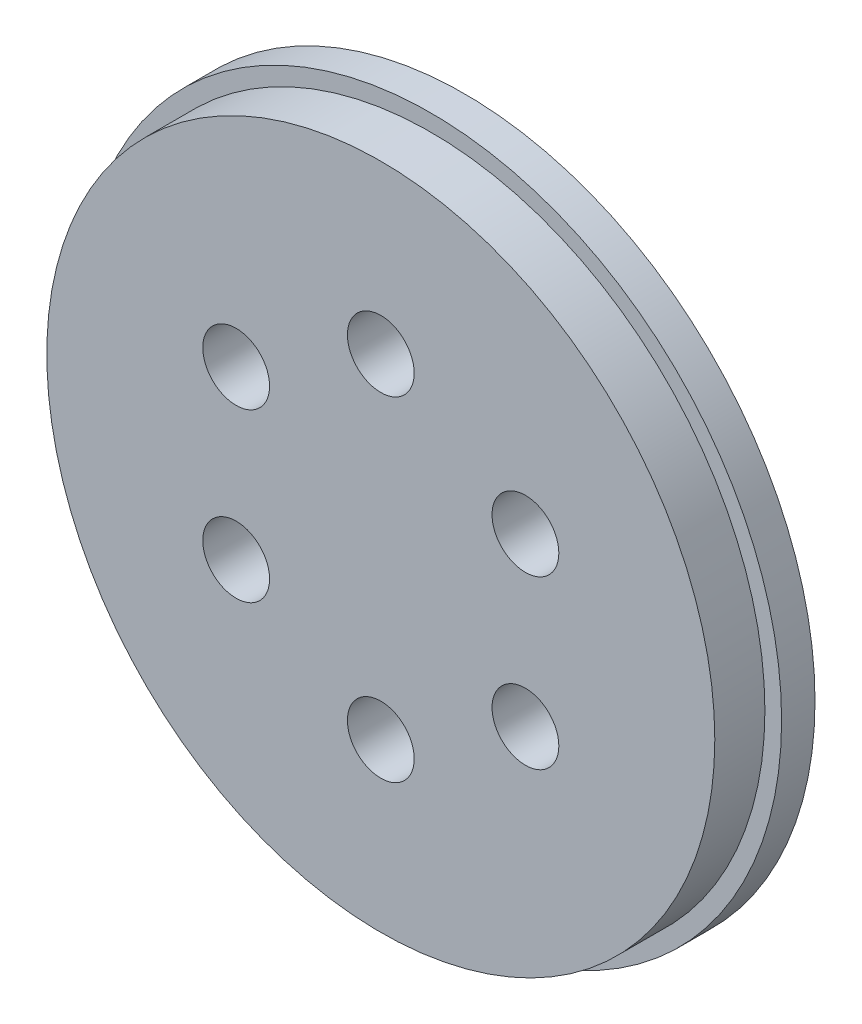
from build123d import *

# Parameters (mm, degrees)
SKETCH_1_R          = 21
EXTRUDE_1_DEPTH     = 2
SKETCH_2_R          = 20
EXTRUDE_2_DEPTH     = 3
SKETCH_3_R          = 2
CUT_EXTRUDE_1_DEPTH = 31.116440693


with BuildPart() as part:
    # 草图1 → 凸台-拉伸1 (new body)
    with BuildSketch(Plane.XY):
        Circle(SKETCH_1_R)
    extrude(amount=EXTRUDE_1_DEPTH)

    # 草图2 → 凸台-拉伸2 (add)
    with BuildSketch(Plane.XY.offset(2)):
        Circle(SKETCH_2_R)
    extrude(amount=EXTRUDE_2_DEPTH)

    # 草图3 → 切除-拉伸1 (cut, through all)
    with BuildSketch(Plane.XY.offset(5)):
        with Locations((0, 10)):
            Circle(SKETCH_3_R)
        with Locations((8.660254038, 5)):
            Circle(SKETCH_3_R)
        with Locations((8.660254038, -5)):
            Circle(SKETCH_3_R)
        with Locations((0, -10)):
            Circle(SKETCH_3_R)
        with Locations((-8.660254038, -5)):
            Circle(SKETCH_3_R)
        with Locations((-8.660254038, 5)):
            Circle(SKETCH_3_R)
    extrude(amount=-CUT_EXTRUDE_1_DEPTH, mode=Mode.SUBTRACT)


solid = part.part
